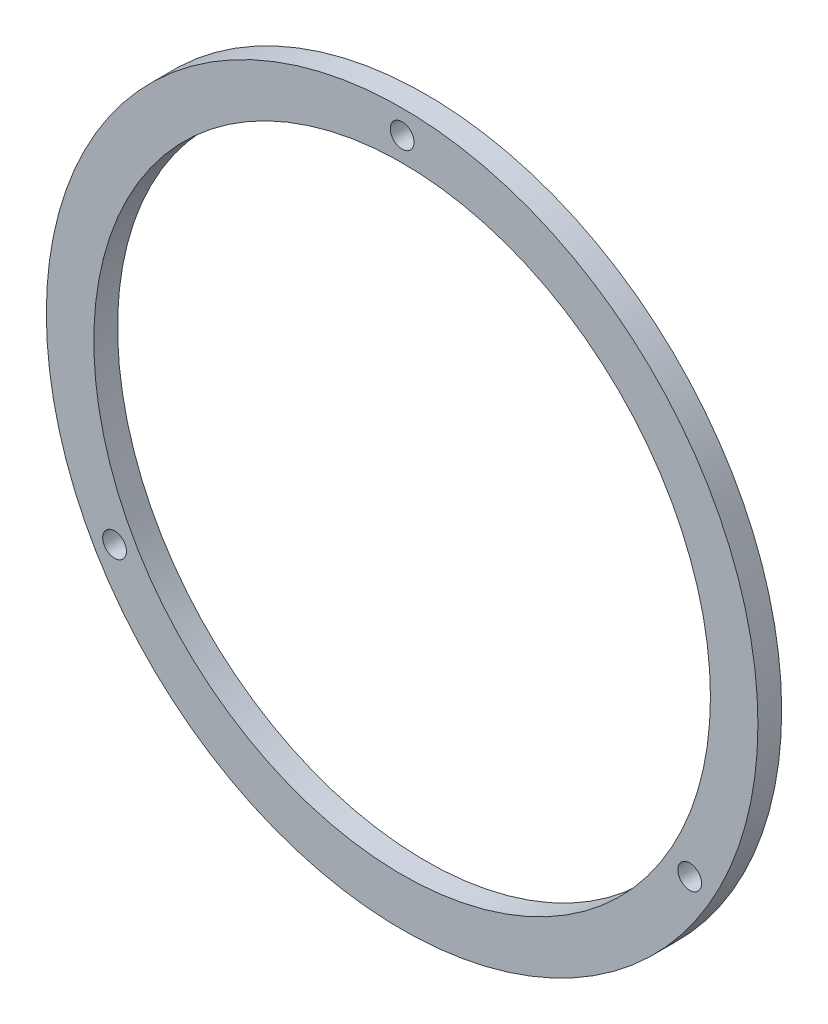
from build123d import *

# Parameters (mm, degrees)
SKETCH1_R           = 95.123
SKETCH1_R_2         = 82.42808
BOSS_EXTRUDE1_DEPTH = 6.35
SKETCH2_R           = 3.175
CUT_EXTRUDE1_DEPTH  = 135.674024066


with BuildPart() as part:
    # Sketch1 → Boss-Extrude1 (new body)
    with BuildSketch(Plane.XY):
        Circle(SKETCH1_R)
        Circle(SKETCH1_R_2, mode=Mode.SUBTRACT)
    extrude(amount=BOSS_EXTRUDE1_DEPTH)

    # Sketch2 → Cut-Extrude1 (cut, through all)
    with BuildSketch(Plane.XY.offset(6.35)):
        with Locations((0, 88.773)):
            Circle(SKETCH2_R)
        with Locations((76.87967317, -44.3865)):
            Circle(SKETCH2_R)
        with Locations((-76.87967317, -44.3865)):
            Circle(SKETCH2_R)
    extrude(amount=-CUT_EXTRUDE1_DEPTH, mode=Mode.SUBTRACT)


solid = part.part
